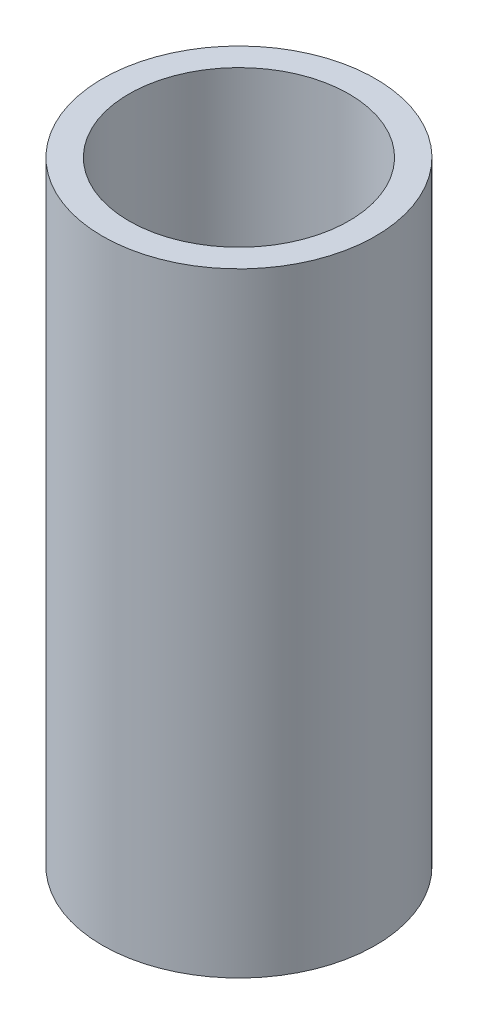
from build123d import *

# Parameters (mm, degrees)
SKETCH1_R           = 8
SKETCH1_R_2         = 6.45
BOSS_EXTRUDE1_DEPTH = 36


with BuildPart() as part:
    # Sketch1 → Boss-Extrude1 (new body)
    with BuildSketch(Plane(origin=(0, 0, 0), x_dir=(1, 0, 0), z_dir=(0, 1, 0))):
        with Locations(Location((0, 0, 0), (0, 0, 270))):
            Circle(SKETCH1_R)
        with Locations(Location((0, 0, 0), (0, 0, 270))):
            Circle(SKETCH1_R_2, mode=Mode.SUBTRACT)
    extrude(amount=BOSS_EXTRUDE1_DEPTH)


solid = part.part
